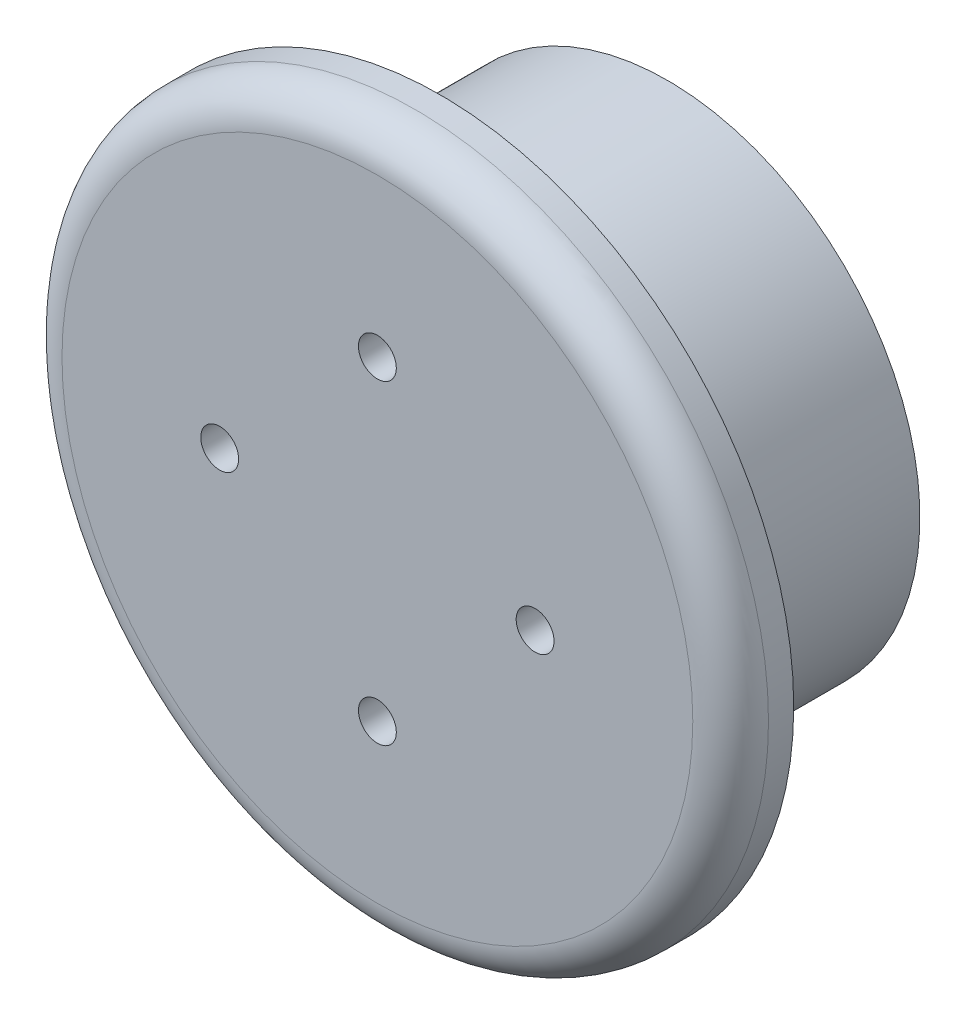
from build123d import *

# Parameters (mm, degrees)
SKETCH1_R                   = 28
BOSS_EXTRUDE1_DEPTH         = 5
FILLET1_R                   = 3
CHAMFER1_SIZE               = 1
TAP_DRILL_FOR_M3_TAP1_D     = 3
TAP_DRILL_FOR_M3_TAP1_DEPTH = 3.098709071
TAP_DRILL_FOR_M3_TAP1_TIP   = 0.901290929


with BuildPart() as part:
    # Sketch1 → Boss-Extrude1 (new body)
    with BuildSketch(Plane(origin=(0, 0, 0), x_dir=(0, 1, 0), z_dir=(0, 0, 1))):
        with Locations(Location((0, 0, 0), (0, 0, 270))):
            Circle(SKETCH1_R)
    extrude(amount=BOSS_EXTRUDE1_DEPTH)

    # Fillet1
    fillet1_edges = [part.edges().sort_by_distance(p)[0] for p in [
        (-28, 0, 5),
    ]]
    fillet(fillet1_edges, radius=FILLET1_R)

    # Sketch2 → Revolve1 (revolve)
    with BuildSketch(Plane.YZ, mode=Mode.PRIVATE) as revolve1_sk:
        Polygon((-19.075, 0), (-19.075, -2), (-20, -2), (-20, -18), (-17.5, -18), (-17.5, -8), (-12, -8), (-12, -2), (0, -2), (0, 0), align=None)
    revolve(revolve1_sk.sketch.rotate(Axis((0, 0, 0), (0, 0, 1)), 270), axis=Axis((0, 0, 0), (0, 0, 1)))

    # Chamfer1
    chamfer1_edges = [part.edges().sort_by_distance(p)[0] for p in [
        (17.5, 0, -18),
    ]]
    chamfer(chamfer1_edges, length=CHAMFER1_SIZE)

    # Tap Drill for M3 Tap1
    with Locations(Plane.XY.offset(5)):
        with Locations((0, 12.5), (-12.5, 0), (0, -12.5), (12.5, 0)):
            Hole(TAP_DRILL_FOR_M3_TAP1_D / 2, depth=TAP_DRILL_FOR_M3_TAP1_DEPTH)
            with Locations((0, 0, -(TAP_DRILL_FOR_M3_TAP1_DEPTH + TAP_DRILL_FOR_M3_TAP1_TIP / 2))):  # 118° drill point
                Cone(0, TAP_DRILL_FOR_M3_TAP1_D / 2, TAP_DRILL_FOR_M3_TAP1_TIP, mode=Mode.SUBTRACT)


solid = part.part
